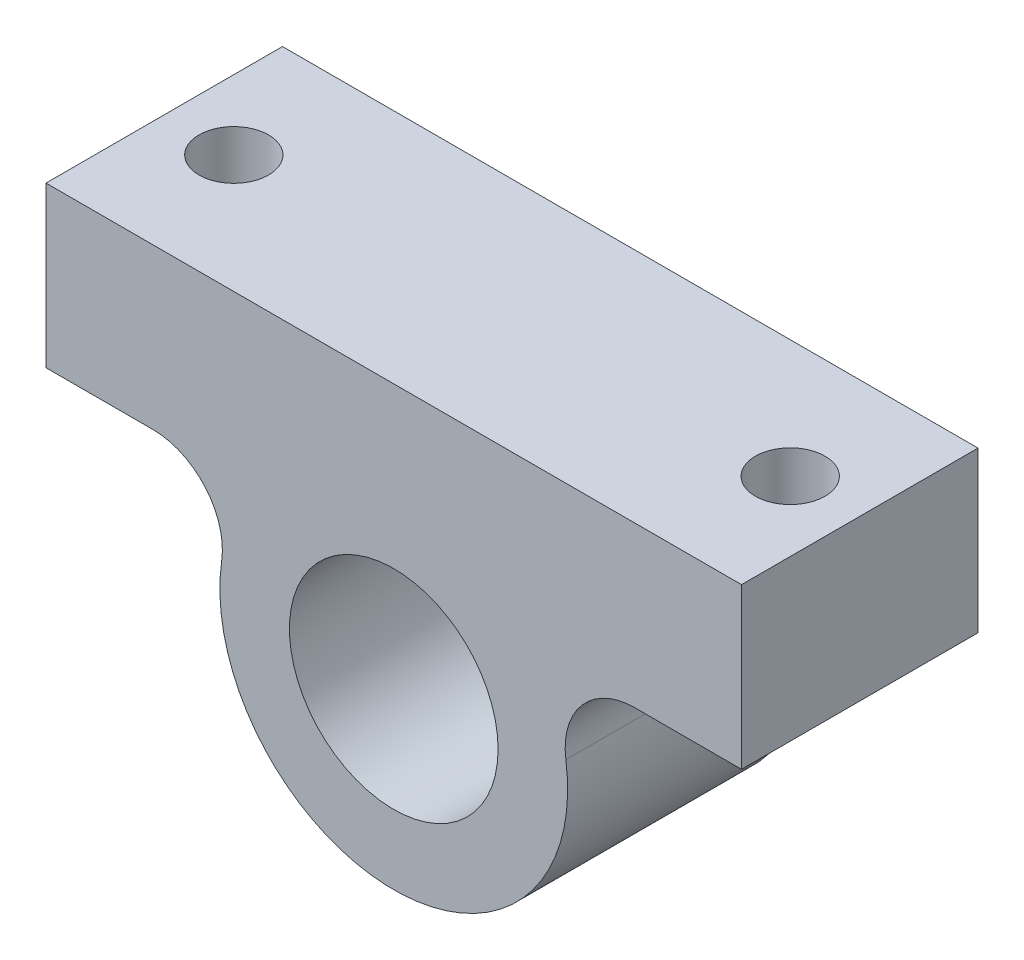
from build123d import *

# Parameters (mm, degrees)
SKETCH1_R                      = 7.5
BOSS_EXTRUDE1_DEPTH            = 17
CUT_EXTRUDE1_REACH             = 45.661
SKETCH2_R                      = 2.5
CUT_EXTRUDE1_DIRECTION_2_DEPTH = 44.660622991
FILLET1_R                      = 5
FILLET2_R                      = 5


with BuildPart() as part:
    # Sketch1 → Boss-Extrude1 (new body)
    with BuildSketch(Plane.XY):
        with BuildLine():
            Line((-25, 19), (25, 19))
            Line((25, 19), (25, 7.5))
            Line((25, 7.5), (10, 7.5))
            ThreePointArc((10, 7.5), (0, -12.5), (-10, 7.5))
            Line((-10, 7.5), (-25, 7.5))
            Line((-25, 7.5), (-25, 19))
        make_face()
        Circle(SKETCH1_R, mode=Mode.SUBTRACT)
    extrude(amount=BOSS_EXTRUDE1_DEPTH)

    # Sketch2 → Cut-Extrude1 (cut, up to next)
    with BuildSketch(Plane(origin=(0, 19, 0), x_dir=(1, 0, 0), z_dir=(0, 1, 0)), mode=Mode.PRIVATE) as cut_extrude1_sk1:
        with Locations(Location((20, -8.5, 0), (0, 0, 90))):
            Circle(SKETCH2_R)
    cut_extrude1_tool1 = extrude(cut_extrude1_sk1.sketch, amount=-CUT_EXTRUDE1_REACH, mode=Mode.PRIVATE) & part.part
    # Sketch2 → Cut-Extrude1 (cut, up to next)
    with BuildSketch(Plane(origin=(0, 19, 0), x_dir=(1, 0, 0), z_dir=(0, 1, 0)), mode=Mode.PRIVATE) as cut_extrude1_sk2:
        with Locations(Location((-20, -8.5, 0), (0, 0, 90))):
            Circle(SKETCH2_R)
    cut_extrude1_tool2 = extrude(cut_extrude1_sk2.sketch, amount=-CUT_EXTRUDE1_REACH, mode=Mode.PRIVATE) & part.part
    add(cut_extrude1_tool1.solids().sort_by_distance((20, 19, 8.5))[0], mode=Mode.SUBTRACT)
    add(cut_extrude1_tool2.solids().sort_by_distance((-20, 19, 8.5))[0], mode=Mode.SUBTRACT)

    # Sketch2 → Cut-Extrude1 direction 2 (cut)
    with BuildSketch(Plane(origin=(0, 19, 0), x_dir=(1, 0, 0), z_dir=(0, 1, 0))):
        with Locations(Location((20, -8.5, 0), (0, 0, 90))):
            Circle(SKETCH2_R)
        with Locations(Location((-20, -8.5, 0), (0, 0, 90))):
            Circle(SKETCH2_R)
    extrude(amount=CUT_EXTRUDE1_DIRECTION_2_DEPTH, mode=Mode.SUBTRACT)

    # Fillet1
    fillet1_edges = [part.edges().sort_by_distance(p)[0] for p in [
        (-10, 7.5, 8.5),
    ]]
    fillet(fillet1_edges, radius=FILLET1_R)

    # Fillet2
    fillet2_edges = [part.edges().sort_by_distance(p)[0] for p in [
        (10, 7.5, 8.5),
    ]]
    fillet(fillet2_edges, radius=FILLET2_R)


solid = part.part
